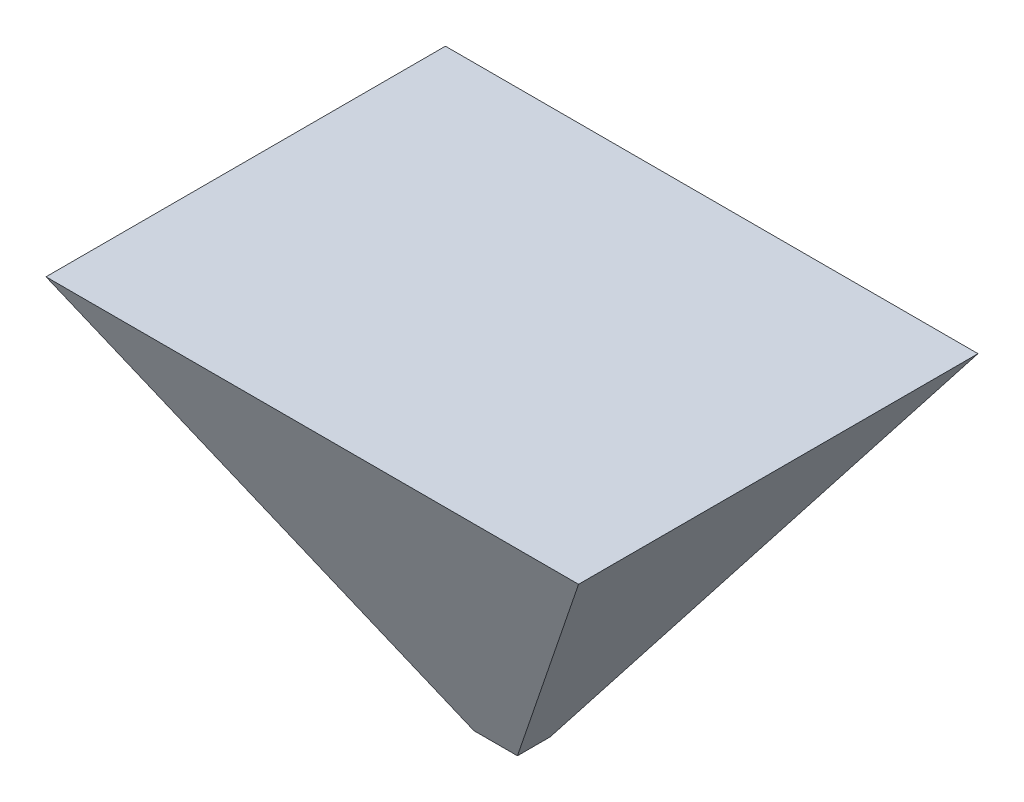
from build123d import *


with BuildPart() as part:
    # Sketch1 → Loft2 section 0
    with BuildSketch(Plane(origin=(0, 0, 0), x_dir=(1, 0, 0), z_dir=(0, 1, 0))):
        with BuildLine():
            Line((-1.8, -1.35), (1.8, -1.35))
            Line((1.8, -1.35), (1.8, 1.35))
            Line((1.8, 1.35), (-1.8, 1.35))
            Line((-1.8, 1.35), (-1.8, -1.35))
        make_face()
    # Sketch5 → Loft2 section 1
    with BuildSketch(Plane(origin=(0, 30, 0), x_dir=(1, 0, 0), z_dir=(0, 1, 0))):
        with BuildLine():
            Line((22.035255505, -16.526441629), (-22.035255505, -16.526441629))
            Line((-22.035255505, -16.526441629), (-22.035255505, 16.526441629))
            Line((-22.035255505, 16.526441629), (22.035255505, 16.526441629))
            Line((22.035255505, 16.526441629), (22.035255505, -16.526441629))
        make_face()
    loft()


solid = part.part
